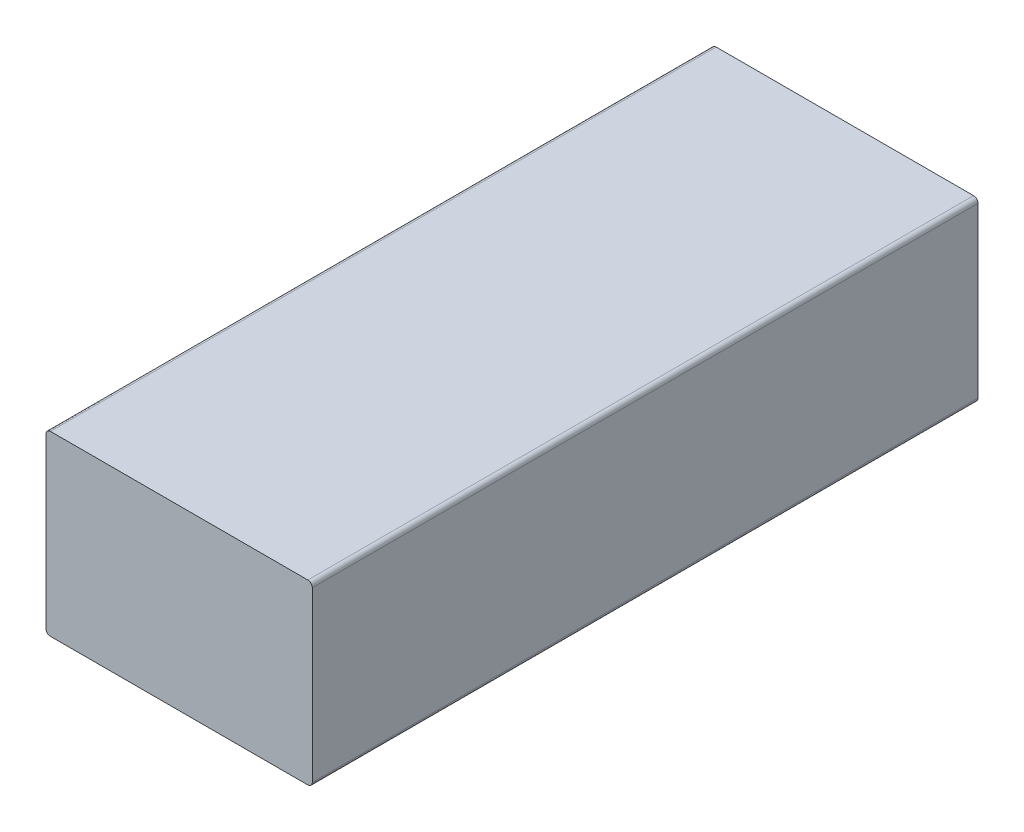
from build123d import *

# Parameters (mm, degrees)
SKETCH_1_W      = 6
SKETCH_1_H      = 4
EXTRUDE_1_DEPTH = 15
FILLET_1_R      = 0.1


with BuildPart() as part:
    # ｽｹｯﾁ1 → ﾎﾞｽ - 押し出し1 (new body)
    with BuildSketch(Plane.XY):
        Rectangle(SKETCH_1_W, SKETCH_1_H)
    extrude(amount=EXTRUDE_1_DEPTH)

    # ﾌｨﾚｯﾄ1
    fillet_1_edges = [part.edges().sort_by_distance(p)[0] for p in [
        (3, -2, 7.5),
        (-3, -2, 7.5),
        (-3, 2, 7.5),
        (3, 2, 7.5),
    ]]
    fillet(fillet_1_edges, radius=FILLET_1_R)


solid = part.part
